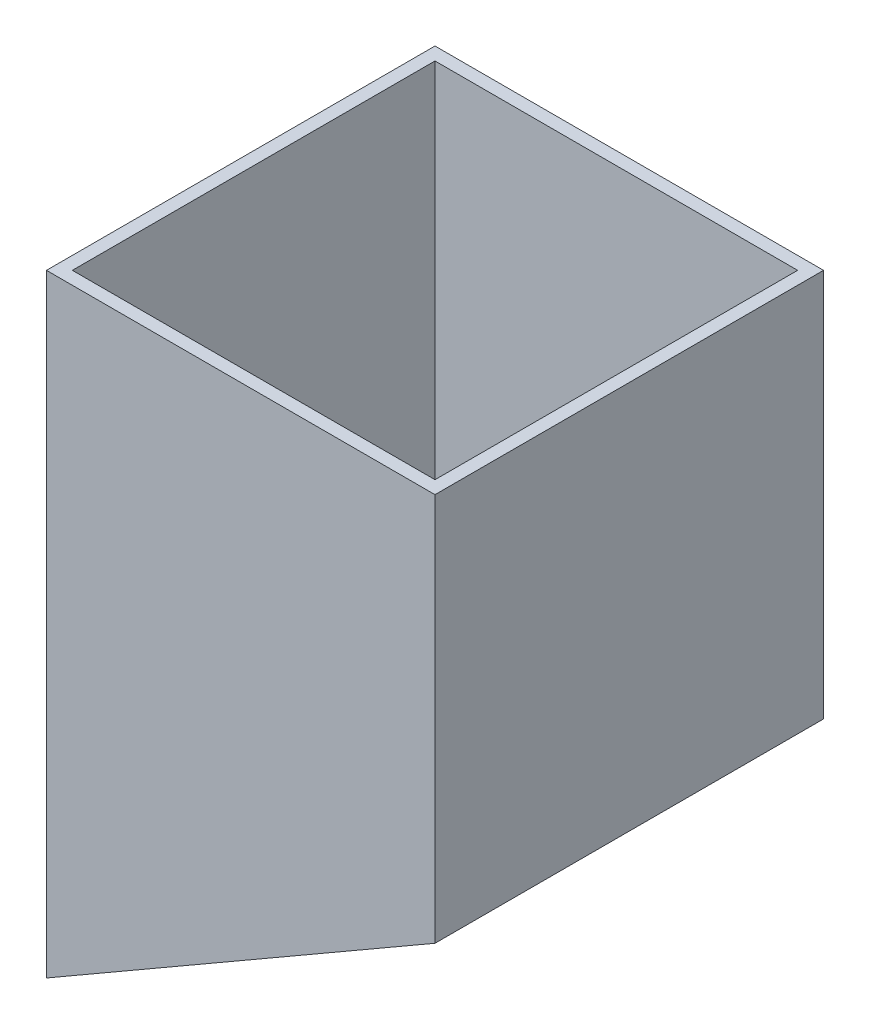
from build123d import *

# Parameters (mm, degrees)
CROQUIS1_W              = 300
CROQUIS1_H              = 300
SALIENTE_EXTRUIR1_DEPTH = 300
SALIENTE_EXTRUIR2_DEPTH = 300
VACIADO4_T              = -10


with BuildPart() as part:
    # Croquis1 → Saliente-Extruir1 (new body)
    with BuildSketch(Plane(origin=(0, 0, 0), x_dir=(1, 0, 0), z_dir=(0, 1, 0))):
        with Locations((150, 150)):
            Rectangle(CROQUIS1_W, CROQUIS1_H)
    extrude(amount=SALIENTE_EXTRUIR1_DEPTH)

    # Croquis2 → Saliente-Extruir2 (add)
    with BuildSketch(Plane.XY):
        Polygon((0, 0), (0, -173.205080757), (300, 0), align=None)
    extrude(amount=-SALIENTE_EXTRUIR2_DEPTH)

    # Vaciado4
    vaciado4_openings = [part.faces().sort_by_distance(p)[0] for p in [
        (150, 300, -150),
    ]]
    offset(amount=VACIADO4_T, openings=vaciado4_openings, kind=Kind.INTERSECTION)


solid = part.part
